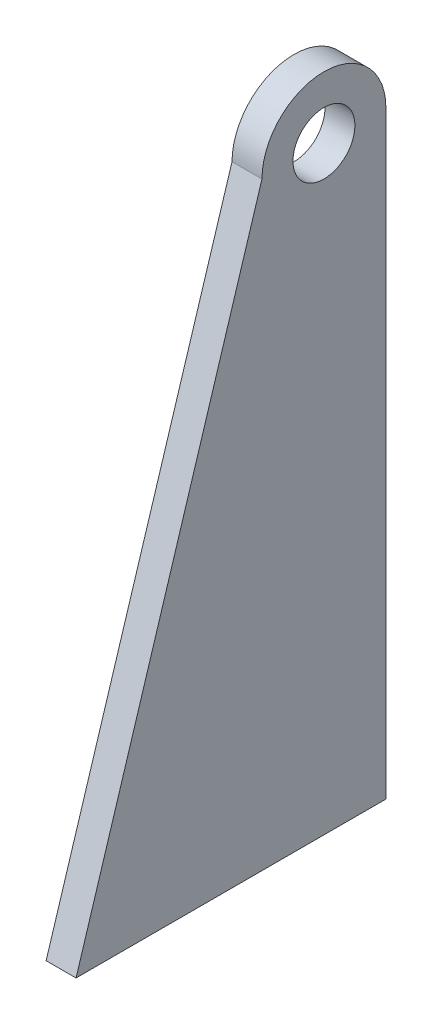
from build123d import *

# Parameters (mm, degrees)
SKETCH2_R           = 6
BOSS_EXTRUDE1_DEPTH = 5.8


with BuildPart() as part:
    # Sketch2 → Boss-Extrude1 (new body)
    with BuildSketch(Plane(origin=(0, 0, 0), x_dir=(0, 0, -1), z_dir=(1, 0, 0))):
        with BuildLine():
            Line((0, 0), (60, 0))
            Line((60, 0), (60, 116))
            ThreePointArc((60, 116), (48, 128), (36, 116))
            Line((36, 116), (0, 0))
        make_face()
        with Locations((48, 116)):
            Circle(SKETCH2_R, mode=Mode.SUBTRACT)
    extrude(amount=BOSS_EXTRUDE1_DEPTH)


solid = part.part
